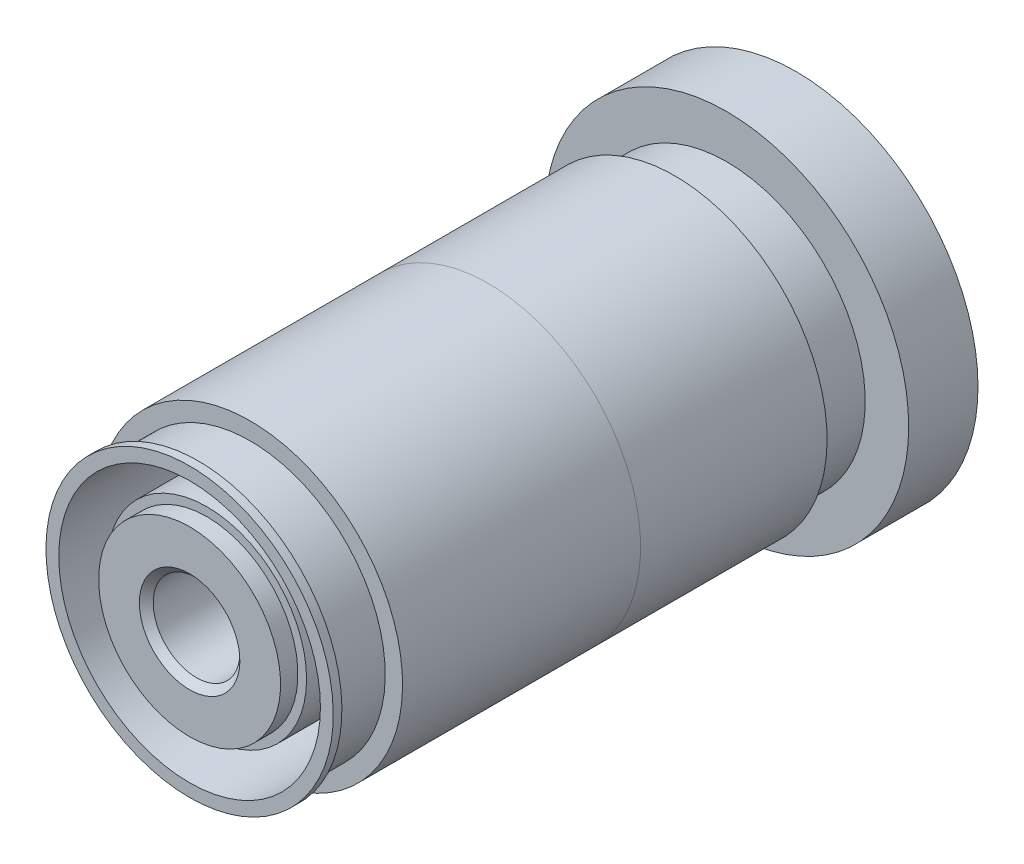
from build123d import *

# Parameters (mm, degrees)
SKETCH4_R          = 25
CUT_EXTRUDE1_DEPTH = 350
CHAMFER1_SIZE      = 4


with BuildPart() as part:
    # Sketch2 → Revolve1 (revolve)
    with BuildSketch(Plane(origin=(0, 0, 0), x_dir=(0, 0, -1), z_dir=(1, 0, 0)), mode=Mode.PRIVATE) as revolve1_sk:
        Polygon((190, 0), (190, 105), (150, 105), (150, 79.9), (120, 79.9), (120, 87.9), (-125, 87.9), (-125, 77.9), (-155, 77.9), (-155, 82.9), (-160, 82.9), (-160, 75.5), (150, 75.5), (150, 57.5), (-150, 57.5), (-150, 52.5), (-160, 52.5), (-160, 0), align=None)
    revolve(revolve1_sk.sketch.rotate(Axis((0, 0, 160), (0, 0, -1)), 180), axis=Axis((0, 0, 160), (0, 0, -1)))

    # Sketch4 → Cut-Extrude1 (cut)
    with BuildSketch(Plane(origin=(0, 0, -190), x_dir=(-1, 0, 0), z_dir=(0, 0, -1))):
        with Locations(Location((0, 0, 0), (0, 0, 90))):
            Circle(SKETCH4_R)
    extrude(amount=-CUT_EXTRUDE1_DEPTH, mode=Mode.SUBTRACT)

    # Chamfer1
    chamfer1_edges = [part.edges().sort_by_distance(p)[0] for p in [
        (0, -25, 160),
    ]]
    chamfer(chamfer1_edges, length=CHAMFER1_SIZE)


solid = part.part
